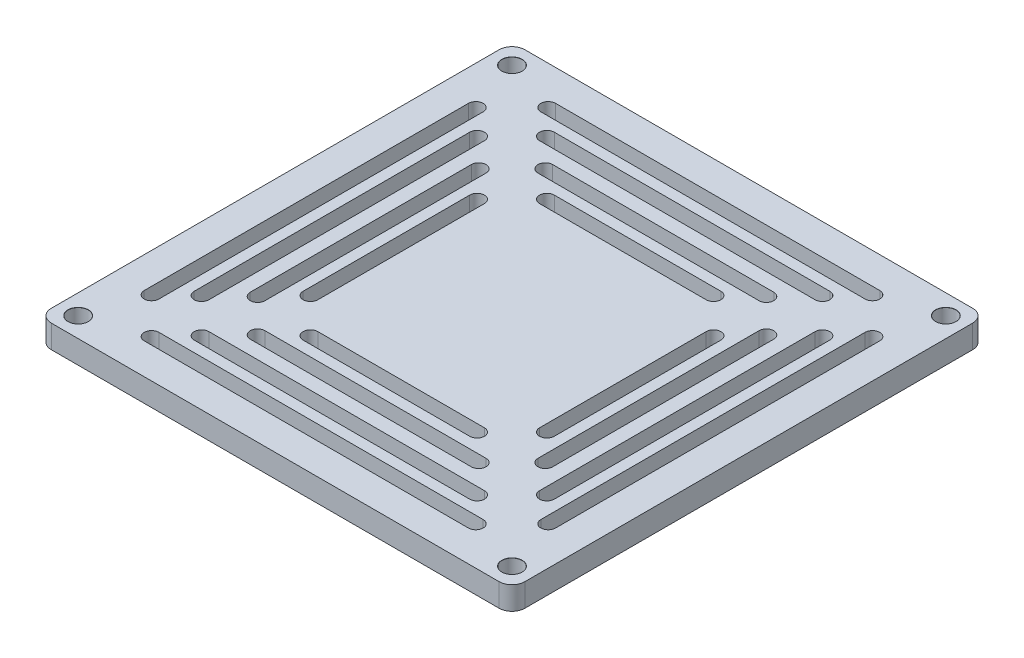
from build123d import *

# Parameters (mm, degrees)
SKETCH1_W                       = 93.853
SKETCH1_H                       = 93.853
BOSS_EXTRUDE1_DEPTH             = 4.572
CUT_EXTRUDE1_DEPTH              = 67.521394968
F_4_0MM_DOWEL_HOLE1_D           = 4
F_4_0MM_DOWEL_HOLE1_CSINK_D     = 4.05
F_4_0MM_DOWEL_HOLE1_CSINK_ANGLE = 90
FILLET2_R                       = 2.54


with BuildPart() as part:
    # Sketch1 → Boss-Extrude1 (new body)
    with BuildSketch(Plane(origin=(0, 0, 0), x_dir=(1, 0, 0), z_dir=(0, 1, 0))):
        Rectangle(SKETCH1_W, SKETCH1_H)
    extrude(amount=BOSS_EXTRUDE1_DEPTH)

    # Sketch3 → Cut-Extrude1 (cut, through all)
    with BuildSketch(Plane(origin=(0, 4.572, 0), x_dir=(1, 0, 0), z_dir=(0, 1, 0))):
        with BuildLine():
            Line((-32.766, -27.305), (-32.766, 27.305))
            ThreePointArc((-32.766, 27.305), (-34.2265, 28.7655), (-35.687, 27.305))
            Line((-35.687, 27.305), (-35.687, -27.305))
            ThreePointArc((-35.687, -27.305), (-34.2265, -28.7655), (-32.766, -27.305))
        make_face()
        with BuildLine():
            Line((-27.051, -21.9075), (-27.051, 21.9075))
            ThreePointArc((-27.051, 21.9075), (-28.5115, 23.368), (-29.972, 21.9075))
            Line((-29.972, 21.9075), (-29.972, -21.9075))
            ThreePointArc((-29.972, -21.9075), (-28.5115, -23.368), (-27.051, -21.9075))
        make_face()
        with BuildLine():
            Line((-21.971, -16.51), (-21.971, 16.51))
            ThreePointArc((-21.971, 16.51), (-23.4315, 17.9705), (-24.892, 16.51))
            Line((-24.892, 16.51), (-24.892, -16.51))
            ThreePointArc((-24.892, -16.51), (-23.4315, -17.9705), (-21.971, -16.51))
        make_face()
        with BuildLine():
            Line((-16.51, 21.971), (16.51, 21.971))
            ThreePointArc((16.51, 21.971), (17.9705, 23.4315), (16.51, 24.892))
            Line((16.51, 24.892), (-16.51, 24.892))
            ThreePointArc((-16.51, 24.892), (-17.9705, 23.4315), (-16.51, 21.971))
        make_face()
        with BuildLine():
            Line((-21.9075, 27.051), (21.9075, 27.051))
            ThreePointArc((21.9075, 27.051), (23.368, 28.5115), (21.9075, 29.972))
            Line((21.9075, 29.972), (-21.9075, 29.972))
            ThreePointArc((-21.9075, 29.972), (-23.368, 28.5115), (-21.9075, 27.051))
        make_face()
        with BuildLine():
            Line((-27.305, 32.766), (27.305, 32.766))
            ThreePointArc((27.305, 32.766), (28.7655, 34.2265), (27.305, 35.687))
            Line((27.305, 35.687), (-27.305, 35.687))
            ThreePointArc((-27.305, 35.687), (-28.7655, 34.2265), (-27.305, 32.766))
        make_face()
        with BuildLine():
            Line((-32.131, 37.846), (32.131, 37.846))
            ThreePointArc((32.131, 37.846), (33.5915, 39.3065), (32.131, 40.767))
            Line((32.131, 40.767), (-32.131, 40.767))
            ThreePointArc((-32.131, 40.767), (-33.5915, 39.3065), (-32.131, 37.846))
        make_face()
        with BuildLine():
            Line((21.971, 16.51), (21.971, -16.51))
            ThreePointArc((21.971, -16.51), (23.4315, -17.9705), (24.892, -16.51))
            Line((24.892, -16.51), (24.892, 16.51))
            ThreePointArc((24.892, 16.51), (23.4315, 17.9705), (21.971, 16.51))
        make_face()
        with BuildLine():
            Line((27.051, 21.9075), (27.051, -21.9075))
            ThreePointArc((27.051, -21.9075), (28.5115, -23.368), (29.972, -21.9075))
            Line((29.972, -21.9075), (29.972, 21.9075))
            ThreePointArc((29.972, 21.9075), (28.5115, 23.368), (27.051, 21.9075))
        make_face()
        with BuildLine():
            Line((32.766, 27.305), (32.766, -27.305))
            ThreePointArc((32.766, -27.305), (34.2265, -28.7655), (35.687, -27.305))
            Line((35.687, -27.305), (35.687, 27.305))
            ThreePointArc((35.687, 27.305), (34.2265, 28.7655), (32.766, 27.305))
        make_face()
        with BuildLine():
            Line((37.846, 32.131), (37.846, -32.131))
            ThreePointArc((37.846, -32.131), (39.3065, -33.5915), (40.767, -32.131))
            Line((40.767, -32.131), (40.767, 32.131))
            ThreePointArc((40.767, 32.131), (39.3065, 33.5915), (37.846, 32.131))
        make_face()
        with BuildLine():
            Line((16.51, -21.971), (-16.51, -21.971))
            ThreePointArc((-16.51, -21.971), (-17.9705, -23.4315), (-16.51, -24.892))
            Line((-16.51, -24.892), (16.51, -24.892))
            ThreePointArc((16.51, -24.892), (17.9705, -23.4315), (16.51, -21.971))
        make_face()
        with BuildLine():
            Line((21.9075, -27.051), (-21.9075, -27.051))
            ThreePointArc((-21.9075, -27.051), (-23.368, -28.5115), (-21.9075, -29.972))
            Line((-21.9075, -29.972), (21.9075, -29.972))
            ThreePointArc((21.9075, -29.972), (23.368, -28.5115), (21.9075, -27.051))
        make_face()
        with BuildLine():
            Line((27.305, -32.766), (-27.305, -32.766))
            ThreePointArc((-27.305, -32.766), (-28.7655, -34.2265), (-27.305, -35.687))
            Line((-27.305, -35.687), (27.305, -35.687))
            ThreePointArc((27.305, -35.687), (28.7655, -34.2265), (27.305, -32.766))
        make_face()
        with BuildLine():
            Line((32.131, -37.846), (-32.131, -37.846))
            ThreePointArc((-32.131, -37.846), (-33.5915, -39.3065), (-32.131, -40.767))
            Line((-32.131, -40.767), (32.131, -40.767))
            ThreePointArc((32.131, -40.767), (33.5915, -39.3065), (32.131, -37.846))
        make_face()
        with BuildLine():
            Line((-40.767, -32.131), (-40.767, 32.131))
            ThreePointArc((-40.767, 32.131), (-39.3065, 33.5915), (-37.846, 32.131))
            Line((-37.846, 32.131), (-37.846, -32.131))
            ThreePointArc((-37.846, -32.131), (-39.3065, -33.5915), (-40.767, -32.131))
        make_face()
    extrude(amount=-CUT_EXTRUDE1_DEPTH, mode=Mode.SUBTRACT)

    # Ø4.0mm Dowel Hole1 (through all)
    with Locations(Plane(origin=(-42.9895, 4.572, 42.9895), x_dir=(0, 0, 1), z_dir=(0, 1, 0))):
        with Locations((0, 0), (-85.979, 0), (-85.979, 85.979), (0, 85.979)):
            CounterSinkHole(F_4_0MM_DOWEL_HOLE1_D / 2, F_4_0MM_DOWEL_HOLE1_CSINK_D / 2, counter_sink_angle=F_4_0MM_DOWEL_HOLE1_CSINK_ANGLE)

    # Fillet2
    fillet2_edges = [part.edges().sort_by_distance(p)[0] for p in [
        (-46.9265, 2.286, 46.9265),
        (46.9265, 2.286, 46.9265),
        (46.9265, 2.286, -46.9265),
        (-46.9265, 2.286, -46.9265),
    ]]
    fillet(fillet2_edges, radius=FILLET2_R)


solid = part.part
